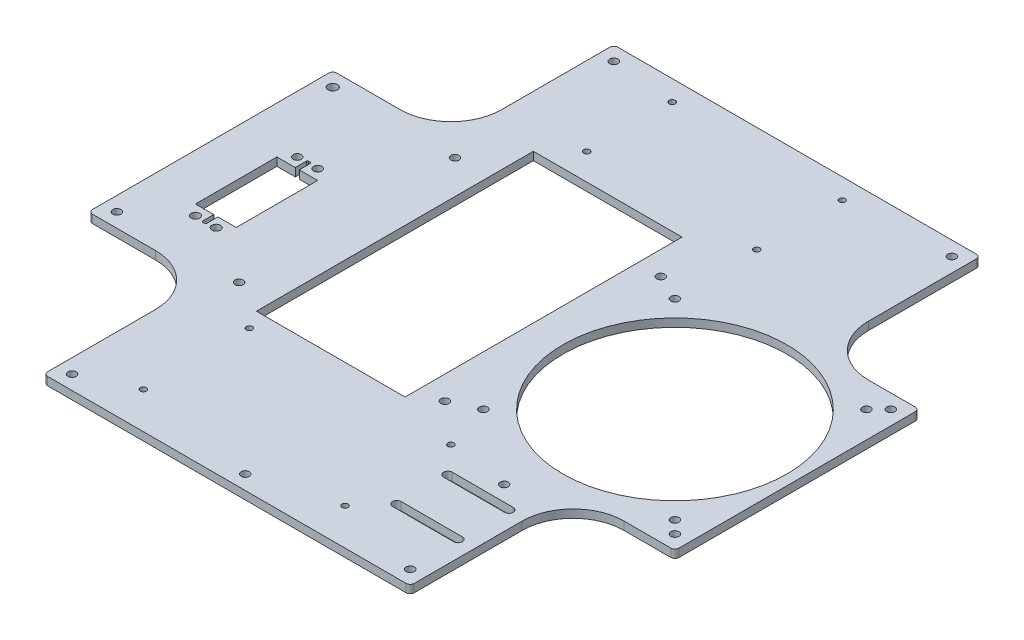
from build123d import *

# Parameters (mm, degrees)
EXTRUDE_1_DEPTH          = 4
CUT_EXTRUDE_2_DEPTH      = 204.764570031
CUT_EXTRUDE_2_DEPTH_BACK = 204.764570031
SKETCH_3_R               = 2
SKETCH_3_R_2             = 2.297041363
SKETCH_4_R               = 55
CUT_EXTRUDE_3_DEPTH      = 10
SKETCH_5_R               = 2
SKETCH_5_R_2             = 2.1
CUT_EXTRUDE_4_DEPTH      = 204.764570031
SKETCH_6_R               = 1.5
CUT_EXTRUDE_5_DEPTH      = 204.764570031
CUT_EXTRUDE_6_DEPTH      = 204.764570031
CUT_EXTRUDE_7_DEPTH      = 204.764570031
CUT_EXTRUDE_7_DEPTH_BACK = 204.764570031
SKETCH_8_W               = 73
SKETCH_8_H               = 136
CUT_EXTRUDE_8_DEPTH      = 204.764570031
CUT_EXTRUDE_8_DEPTH_BACK = 204.764570031
SKETCH_9_R               = 1.5
SKETCH_9_R_2             = 1.441079752
FILLET_1_R               = 2
FILLET_2_R               = 25
FILLET_3_R               = 25


with BuildPart() as part:
    # 草图1 → 凸台-拉伸1 (new body)
    with BuildSketch(Plane(origin=(0, 0, 0), x_dir=(1, 0, 0), z_dir=(0, 1, 0))):
        Polygon((-90, -140), (90, -140), (90, -60), (140, -60), (140, 60), (90, 60), (90, 140), (-90, 140), (-90, 60), (-140, 60), (-148, 60), (-148, -60), (-140, -60), (-90, -60), align=None)
    extrude(amount=EXTRUDE_1_DEPTH)

    # 草图3 → 切除-拉伸2 (cut, two sides: drawn at the far end of the back side and taken through both)
    with BuildSketch(Plane(origin=(0, 4, 0), x_dir=(1, 0, 0), z_dir=(0, 1, 0)).offset(-CUT_EXTRUDE_2_DEPTH_BACK)):
        with Locations(Location((-83, -133, 0), (0, 0, 270))):
            Circle(SKETCH_3_R)
        with Locations(Location((83, -133, 0), (0, 0, 270))):
            Circle(SKETCH_3_R)
        with Locations(Location((-83, 133, 0), (0, 0, 270))):
            Circle(SKETCH_3_R)
        with Locations(Location((83, 133, 0), (0, 0, 270))):
            Circle(SKETCH_3_R)
        with Locations(Location((133, 53, 0), (0, 0, 270))):
            Circle(SKETCH_3_R)
        with Locations(Location((133, -53, 0), (0, 0, 270))):
            Circle(SKETCH_3_R)
        with Locations(Location((32.977399051, 47.022600949, 0), (0, 0, 270))):
            Circle(SKETCH_3_R)
        with Locations(Location((127.022600949, 47.022600949, 0), (0, 0, 270))):
            Circle(SKETCH_3_R)
        with Locations(Location((127.022600949, -47.022600949, 0), (0, 0, 270))):
            Circle(SKETCH_3_R)
        with Locations(Location((32.977399051, -47.022600949, 0), (0, 0, 270))):
            Circle(SKETCH_3_R)
        with Locations(Location((-141, 53, 0), (0, 0, 270))):
            Circle(SKETCH_3_R_2)
        with Locations(Location((-141, -53, 0), (0, 0, 270))):
            Circle(SKETCH_3_R)
        with Locations(Location((20, -53, 0), (0, 0, 270))):
            Circle(SKETCH_3_R)
        with Locations(Location((20, 53, 0), (0, 0, 270))):
            Circle(SKETCH_3_R)
        with Locations(Location((-81, 53, 0), (0, 0, 270))):
            Circle(SKETCH_3_R)
        with Locations(Location((-81, -53, 0), (0, 0, 270))):
            Circle(SKETCH_3_R)
        with Locations(Location((70, -73.854225456, 0), (0, 0, 270))):
            Circle(SKETCH_3_R)
        with Locations(Location((2, -133, 0), (0, 0, 270))):
            Circle(SKETCH_3_R)
    extrude(amount=CUT_EXTRUDE_2_DEPTH + CUT_EXTRUDE_2_DEPTH_BACK, mode=Mode.SUBTRACT)

    # 草图4 → 切除-拉伸3 (cut)
    with BuildSketch(Plane(origin=(0, 4, 0), x_dir=(1, 0, 0), z_dir=(0, 1, 0))):
        with Locations(Location((80, 0, 0), (0, 0, 270))):
            Circle(SKETCH_4_R)
    extrude(amount=-CUT_EXTRUDE_3_DEPTH, mode=Mode.SUBTRACT)

    # 草图5 → 切除-拉伸4 (cut, through all)
    with BuildSketch(Plane(origin=(0, 4, 0), x_dir=(1, 0, 0), z_dir=(0, 1, 0))):
        with Locations(Location((-110.053769942, 14.625081272, 0), (0, 0, 270))):
            Circle(SKETCH_5_R)
        with Locations(Location((-120.053769942, 14.625081272, 0), (0, 0, 270))):
            Circle(SKETCH_5_R)
        with Locations(Location((-120.053769942, -35.374918728, 0), (0, 0, 270))):
            Circle(SKETCH_5_R_2)
        with Locations(Location((-109.860583636, -35.374918728, 0), (0, 0, 270))):
            Circle(SKETCH_5_R_2)
        Polygon((-105.053769942, 9.625081272), (-105.053769942, -30.374918728), (-114.053769942, -30.374918728), (-114.053769942, -35.874918728), (-114.553769942, -36.374918728), (-115.553769942, -36.374918728), (-116.053769942, -35.874918728), (-116.053769942, -30.374918728), (-125.053769942, -30.374918728), (-125.053769942, 9.625081272), (-116.053769942, 9.625081272), (-116.053769942, 15.125081272), (-115.553769942, 15.625081272), (-114.553769942, 15.625081272), (-114.053769942, 15.125081272), (-114.053769942, 9.625081272), align=None)
    extrude(amount=-CUT_EXTRUDE_4_DEPTH, mode=Mode.SUBTRACT)

    # 草图6 → 切除-拉伸5 (cut, through all)
    with BuildSketch(Plane(origin=(0, 4, 0), x_dir=(1, 0, 0), z_dir=(0, 1, 0))):
        with Locations(Location((40, -122, 0), (0, 0, 270))):
            Circle(SKETCH_6_R)
        with Locations(Location((40, -70, 0), (0, 0, 270))):
            Circle(SKETCH_6_R)
        with Locations(Location((-59, -122, 0), (0, 0, 270))):
            Circle(SKETCH_6_R)
        with Locations(Location((-59, -70, 0), (0, 0, 270))):
            Circle(SKETCH_6_R)
    extrude(amount=-CUT_EXTRUDE_5_DEPTH, mode=Mode.SUBTRACT)

    # 草图7 → 切除-拉伸6 (cut, through all)
    with BuildSketch(Plane(origin=(0, 4, 0), x_dir=(1, 0, 0), z_dir=(0, 1, 0))):
        with BuildLine():
            Line((82, -110.6), (52, -110.6))
            ThreePointArc((52, -110.6), (49.9, -108.5), (52, -106.4))
            Line((52, -106.4), (82, -106.4))
            ThreePointArc((82, -106.4), (84.1, -108.5), (82, -110.6))
        make_face()
        with BuildLine():
            Line((82, -85.6), (52, -85.6))
            ThreePointArc((52, -85.6), (49.9, -83.5), (52, -81.4))
            Line((52, -81.4), (82, -81.4))
            ThreePointArc((82, -81.4), (84.1, -83.5), (82, -85.6))
        make_face()
    extrude(amount=-CUT_EXTRUDE_6_DEPTH, mode=Mode.SUBTRACT)

    # 草图8 → 切除-拉伸7 (cut, two sides: drawn at the far end of the back side and taken through both)
    with BuildSketch(Plane(origin=(0, 4, 0), x_dir=(1, 0, 0), z_dir=(0, 1, 0)).offset(-CUT_EXTRUDE_7_DEPTH_BACK)):
        with Locations((-28, 7)):
            Rectangle(SKETCH_8_W, SKETCH_8_H)
    extrude(amount=CUT_EXTRUDE_7_DEPTH + CUT_EXTRUDE_7_DEPTH_BACK, mode=Mode.SUBTRACT)

    # 草图9 → 切除-拉伸8 (cut, two sides: drawn at the far end of the back side and taken through both)
    with BuildSketch(Plane(origin=(0, 4, 0), x_dir=(1, 0, 0), z_dir=(0, 1, 0)).offset(-CUT_EXTRUDE_8_DEPTH_BACK)):
        with Locations(Location((-51.339528663, 88, 0), (0, 0, 270))):
            Circle(SKETCH_9_R)
        with Locations(Location((-51.339528663, 130, 0), (0, 0, 270))):
            Circle(SKETCH_9_R)
        with Locations(Location((32.160471337, 130, 0), (0, 0, 270))):
            Circle(SKETCH_9_R_2)
        with Locations(Location((32.160471337, 88, 0), (0, 0, 270))):
            Circle(SKETCH_9_R)
    extrude(amount=CUT_EXTRUDE_8_DEPTH + CUT_EXTRUDE_8_DEPTH_BACK, mode=Mode.SUBTRACT)

    # 圆角1
    fillet_1_edges = [part.edges().sort_by_distance(p)[0] for p in [
        (-148, 2, -60),
        (-90, 2, -140),
        (90, 2, -140),
        (140, 2, -60),
        (140, 2, 60),
        (90, 2, 140),
        (-90, 2, 140),
        (-148, 2, 60),
    ]]
    fillet(fillet_1_edges, radius=FILLET_1_R)

    # 圆角2
    fillet_2_edges = [part.edges().sort_by_distance(p)[0] for p in [
        (-90, 2, 60),
    ]]
    fillet(fillet_2_edges, radius=FILLET_2_R)

    # 圆角3
    fillet_3_edges = [part.edges().sort_by_distance(p)[0] for p in [
        (-90, 2, -60),
        (90, 2, -60),
        (90, 2, 60),
    ]]
    fillet(fillet_3_edges, radius=FILLET_3_R)


solid = part.part
